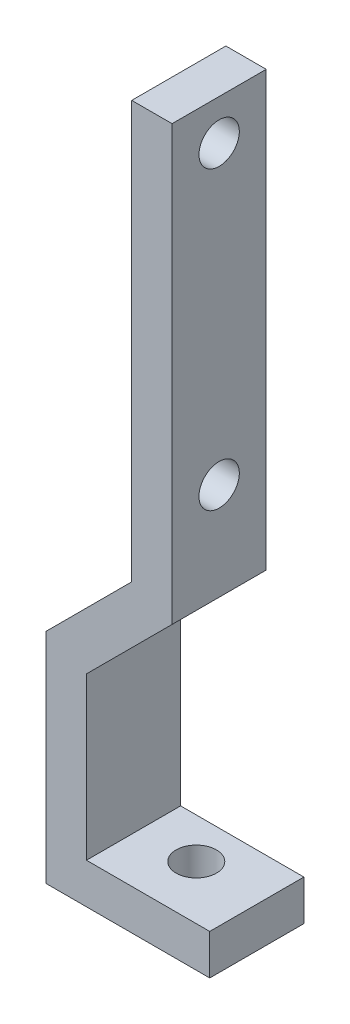
from build123d import *

# Parameters (mm, degrees)
SKETCH_1_W          = 1.5
SKETCH_1_H          = 3
SKETCH_1_W_2        = 3.5
EXTRUDE_1_DEPTH     = 7
SKETCH_2_R          = 1.5
CUT_EXTRUDE_2_DEPTH = 7
SKETCH_4_R          = 1.5
CUT_EXTRUDE_3_DEPTH = 7


with BuildPart() as part:
    # 草图1 → 凸台-拉伸1 (new body)
    with BuildSketch(Plane.XY):
        Polygon((-0.641080243, 21.986723194), (-3.641080243, 21.986723194), (-3.641080243, -9.013276806), (-10.005041274, -15.377237837), (-10.005041274, -31.619878524), (-4.341080243, -31.619878524), (-4.341080243, -28.619878524), (-7.005041274, -28.619878524), (-7.005041274, -16.619878524), (-0.641080243, -10.255917493), align=None)
        with Locations((-2.091080243, -30.119878524)):
            Rectangle(SKETCH_1_W, SKETCH_1_H)
        with Locations((-3.591080243, -30.119878524)):
            Rectangle(SKETCH_1_W, SKETCH_1_H)
        with Locations((0.408919757, -30.119878524)):
            Rectangle(SKETCH_1_W_2, SKETCH_1_H)
    extrude(amount=EXTRUDE_1_DEPTH)

    # 草图2 → 切除-拉伸2 (cut)
    with BuildSketch(Plane.ZY.offset(3.641080243)):
        with Locations(Location((3.5, 18.986723194, 0), (0, 0, 270))):
            Circle(SKETCH_2_R)
        with Locations(Location((3.5, -3.013276806, 0), (0, 0, 270))):
            Circle(SKETCH_2_R)
    extrude(amount=-CUT_EXTRUDE_2_DEPTH, mode=Mode.SUBTRACT)

    # 草图4 → 切除-拉伸3 (cut)
    with BuildSketch(Plane(origin=(0, -28.619878524, 0), x_dir=(1, 0, 0), z_dir=(0, 1, 0))):
        with Locations(Location((-2.841080243, -3, 0), (0, 0, 270))):
            Circle(SKETCH_4_R)
    extrude(amount=-CUT_EXTRUDE_3_DEPTH, mode=Mode.SUBTRACT)


solid = part.part
